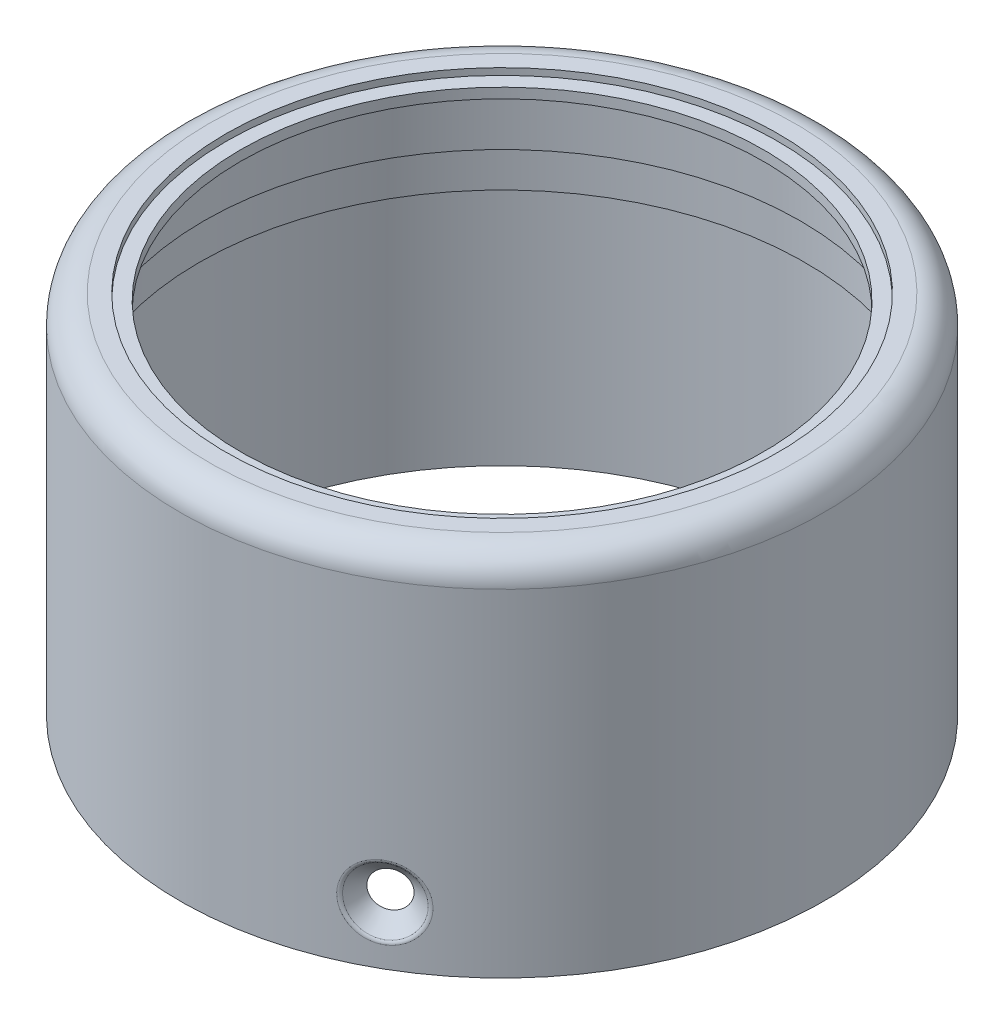
from build123d import *

# Parameters (mm, degrees)
CIRPATTERN2_COUNT = 3
FILLET1_R         = 0.5


with BuildPart() as part:
    # Sketch1 → Revolve1 (revolve)
    with BuildSketch(Plane.XY):
        with BuildLine():
            Line((-27.2, 23.3), (-27.2, 22.25))
            Line((-27.2, 22.25), (-29, 22.25))
            Line((-29, 22.25), (-29, 22))
            Line((-29, 22), (-31, 22))
            Line((-31, 22), (-31, 15))
            Line((-31, 15), (-31.5, 15))
            Line((-31.5, 15), (-31.5, 11))
            Line((-31.5, 11), (-31.75, 11))
            Line((-31.75, 11), (-31.75, -14))
            Line((-31.75, -14), (-33.5, -14))
            Line((-33.5, -14), (-33.5, 21))
            ThreePointArc((-33.5, 21), (-32.621320344, 23.121320344), (-30.5, 24))
            Line((-30.5, 24), (-28.7, 24))
            Line((-28.7, 24), (-28.7, 23.3))
            Line((-28.7, 23.3), (-27.2, 23.3))
        make_face()
    revolve(axis=Axis((0, -0.222595104, 0), (0, -1, 0)))

    # Sketch4 → Cut-Revolve1 (revolve, cut)
    with BuildSketch(Plane.XY):
        Polygon((-33.5, -8), (-25.29746816, -8), (-25.29746816, -6.4), (-31.5, -6.4), (-33.5, -4.4), align=None)
    cut_revolve1 = revolve(axis=Axis((-29.768934642, -8, 0), (1, 0, 0)), mode=Mode.SUBTRACT)

    # CirPattern2: Cut-Revolve1 ×3 about axis
    cirpattern2_axis = Axis((0, 0, 0), (0, 1, 0))
    for i in range(1, CIRPATTERN2_COUNT):
        add(cut_revolve1.rotate(cirpattern2_axis, i * 360 / CIRPATTERN2_COUNT), mode=Mode.SUBTRACT)

    # Fillet1
    fillet1_edges = [part.edges().sort_by_distance(p)[0] for p in [
        (-33.324506796, -8, 3.424506796),
        (16.750000115, -11.6, 29.01185096),
        (16.749999851, -11.6, -29.011851113),
    ]]
    fillet(fillet1_edges, radius=FILLET1_R)


solid = part.part
